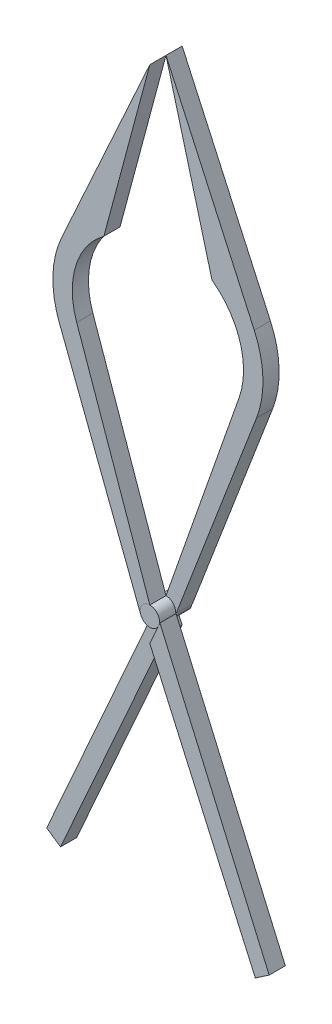
from build123d import *

# Parameters (mm, degrees)
BOSS_EXTRUDE30_DEPTH = 2.5
BOSS_EXTRUDE31_DEPTH = 2.5
BOSS_EXTRUDE34_DEPTH = 2.5
BOSS_EXTRUDE39_DEPTH = 2.5
BOSS_EXTRUDE40_DEPTH = 2.5


with BuildPart() as part:
    # Sketch1 → Boss-Extrude30 (new, symmetric)
    with BuildSketch(Plane.XY):
        with BuildLine():
            ThreePointArc((1.495748311, -37.682643513), (1.057653773, -36.62498974), (0, -36.186895202))
            ThreePointArc((0, -36.186895202), (-1.232685354, -36.835442341), (-1.396401346, -38.218671768))
            ThreePointArc((-1.396401346, -38.218671768), (-1.381877755, -38.25507419), (-1.366405387, -38.291083589))
            ThreePointArc((-1.366405387, -38.291083589), (-0.039118875, -39.177880191), (1.332721503, -38.361699036))
            Line((1.332721503, -38.361699036), (1.396401346, -38.218671768))
            ThreePointArc((1.396401346, -38.218671768), (1.470701867, -37.955221993), (1.495748311, -37.682643513))
        make_face()
    extrude(amount=BOSS_EXTRUDE30_DEPTH, both=True)

    # Sketch1<9> → Boss-Extrude31 (add)
    with BuildSketch(Plane.XY):
        with BuildLine():
            Line((13.652695817, 6.213203436), (0, 36.213203436))
            Line((0, 36.213203436), (7.113830396, 9.664026961))
            ThreePointArc((7.113830396, 9.664026961), (11.4671721, 3.536094459), (11.320991311, -3.979341118))
            Line((11.320991311, -3.979341118), (0, -36.186895202))
            ThreePointArc((0, -36.186895202), (1.057653773, -36.62498974), (1.495748311, -37.682643513))
            Line((1.495748311, -37.682643513), (1.55237162, -37.812355314))
            Line((1.55237162, -37.812355314), (14.003706397, -5.375519243))
            ThreePointArc((14.003706397, -5.375519243), (14.993124064, 0.454126423), (13.652695817, 6.213203436))
        make_face()
    extrude(amount=-BOSS_EXTRUDE31_DEPTH)


with BuildPart() as body_2:
    # Sketch1<11> → Boss-Extrude34 (new body)
    with BuildSketch(Plane.XY):
        with BuildLine():
            Line((-7.113830396, 9.664026961), (0, 36.213203436))
            Line((0, 36.213203436), (-13.652695817, 6.213203436))
            ThreePointArc((-13.652695817, 6.213203436), (-14.993124064, 0.454126423), (-14.003706397, -5.375519243))
            Line((-14.003706397, -5.375519243), (-1.396401346, -38.218671768))
            ThreePointArc((-1.396401346, -38.218671768), (-1.232685354, -36.835442341), (0, -36.186895202))
            Line((0, -36.186895202), (-11.320991311, -3.979341118))
            ThreePointArc((-11.320991311, -3.979341118), (-11.4671721, 3.536094459), (-7.113830396, 9.664026961))
        make_face()
    extrude(amount=BOSS_EXTRUDE34_DEPTH)


with BuildPart() as body_3:
    # Sketch1<15> → Boss-Extrude39 (new body)
    with BuildSketch(Plane.XY):
        with BuildLine():
            Line((18.461180216, -76.546792649), (1.55237162, -37.812355314))
            Line((1.55237162, -37.812355314), (1.396401346, -38.218671768))
            ThreePointArc((1.396401346, -38.218671768), (1.366434075, -38.29101916), (1.332721503, -38.361699036))
            Line((1.332721503, -38.361699036), (-0.001035308, -41.357365883))
            Line((-0.001035308, -41.357365883), (16.317854893, -78.005542703))
            Line((16.317854893, -78.005542703), (18.461180216, -76.546792649))
        make_face()
    extrude(amount=BOSS_EXTRUDE39_DEPTH)


with BuildPart() as body_4:
    # Sketch1<16> → Boss-Extrude40 (new body)
    with BuildSketch(Plane.XY):
        with BuildLine():
            ThreePointArc((-1.366405387, -38.291083589), (-1.381877755, -38.25507419), (-1.396401346, -38.218671768))
            Line((-1.396401346, -38.218671768), (-18.461180216, -76.546792649))
            Line((-18.461180216, -76.546792649), (-16.317854893, -78.005542703))
            Line((-16.317854893, -78.005542703), (-0.001035308, -41.357365883))
            Line((-0.001035308, -41.357365883), (-1.366405387, -38.291083589))
        make_face()
    extrude(amount=-BOSS_EXTRUDE40_DEPTH)


solid = Compound([part.part, body_2.part, body_3.part, body_4.part])
